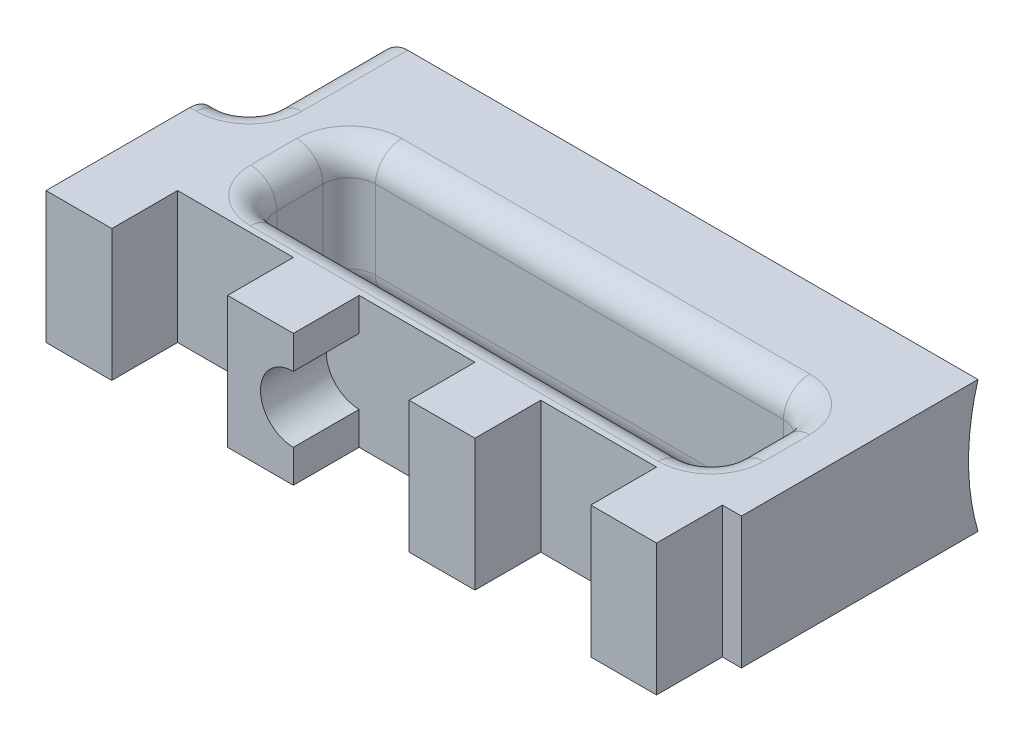
from build123d import *

# Parameters (mm, degrees)
SKETCH1_W           = 44.45
SKETCH1_H           = 9.525
BOSS_EXTRUDE1_DEPTH = 12.7
FILLET1_R           = 2.54
FILLET2_R           = 2.54
CUT_EXTRUDE2_DEPTH  = 6.35
CUT_EXTRUDE6_DEPTH  = 68.493049433
CUT_EXTRUDE7_DEPTH  = 3.175
SKETCH5_W           = 9.525
SKETCH5_H           = 12.7
CUT_EXTRUDE8_DEPTH  = 3.175
FILLET3_R           = 2.54


with BuildPart() as part:
    # Sketch1 → Boss-Extrude1 (new body)
    with BuildSketch(Plane(origin=(0, 0, 0), x_dir=(1, 0, 0), z_dir=(0, 1, 0))):
        Polygon((26.819703528, -20.131014632), (28.659931952, -20.131014632), (28.659931952, 17.968985368), (-28.898317878, 17.968985368), (-28.898317878, 12.851244956), (-32.108296472, 12.851244956), (-32.108296472, -20.131014632), (-32.108296472, -26.481014632), (-25.758296472, -26.481014632), (-25.758296472, -20.131014632), (-14.582296472, -20.131014632), (-14.582296472, -26.481014632), (-8.232296472, -26.481014632), (-8.232296472, -20.131014632), (2.943703528, -20.131014632), (2.943703528, -26.481014632), (9.293703528, -26.481014632), (9.293703528, -20.131014632), (20.469703528, -20.131014632), (20.469703528, -26.481014632), (26.819703528, -26.481014632), align=None)
        with Locations((0.396638353, -12.259443339)):
            Rectangle(SKETCH1_W, SKETCH1_H, mode=Mode.SUBTRACT)
    extrude(amount=BOSS_EXTRUDE1_DEPTH)

    # Fillet1
    fillet1_edges = [part.edges().sort_by_distance(p)[0] for p in [
        (22.621638353, 6.35, 17.021943339),
        (22.621638353, 6.35, 7.496943339),
        (-21.828361647, 6.35, 7.496943339),
        (-21.828361647, 6.35, 17.021943339),
    ]]
    fillet(fillet1_edges, radius=FILLET1_R)

    # Fillet2
    fillet2_edges = [part.edges().sort_by_distance(p)[0] for p in [
        (0.396638353, 0, 17.021943339),
        (0.396638353, 12.7, 17.021943339),
        (22.621638353, 0, 12.259443339),
        (22.621638353, 12.7, 12.259443339),
        (0.396638353, 0, 7.496943339),
        (0.396638353, 12.7, 7.496943339),
        (-21.828361647, 0, 12.259443339),
        (-21.828361647, 12.7, 12.259443339),
        (21.877689577, 0, 16.277994563),
        (21.877689577, 12.7, 16.277994563),
        (21.877689577, 0, 8.240892115),
        (21.877689577, 12.7, 8.240892115),
        (-21.084412871, 0, 8.240892115),
        (-21.084412871, 12.7, 8.240892115),
        (-21.084412871, 0, 16.277994563),
        (-21.084412871, 12.7, 16.277994563),
    ]]
    fillet(fillet2_edges, radius=FILLET2_R)

    # Sketch3 → Cut-Extrude2 (cut)
    with BuildSketch(Plane.XY.offset(26.481014632)):
        with BuildLine():
            Line((-8.232296472, 9.525), (-8.232296472, 3.175))
            ThreePointArc((-8.232296472, 3.175), (-11.407296472, 6.35), (-8.232296472, 9.525))
        make_face()
    extrude(amount=-CUT_EXTRUDE2_DEPTH, mode=Mode.SUBTRACT)

    # Sketch2 → Cut-Extrude6 (cut, through all)
    with BuildSketch(Plane(origin=(28.659931952, 0, 0), x_dir=(0, 0, -1), z_dir=(1, 0, 0))):
        with BuildLine():
            Line((2.702570586, 12.7), (17.968985368, 12.7))
            Line((17.968985368, 12.7), (17.968985368, 0))
            Line((17.968985368, 0), (2.702570586, 0))
            ThreePointArc((2.702570586, 0), (1.789185368, 6.35), (2.702570586, 12.7))
        make_face()
    extrude(amount=-CUT_EXTRUDE6_DEPTH, mode=Mode.SUBTRACT)

    # Sketch4 → Cut-Extrude7 (cut)
    with BuildSketch(Plane.ZY.offset(32.108296472)):
        with BuildLine():
            Line((0.536702432, 0), (-10.240735591, 0))
            Line((-10.240735591, 0), (-10.240735591, 12.7))
            Line((-10.240735591, 12.7), (0.536702432, 12.7))
            ThreePointArc((0.536702432, 12.7), (1.335014632, 6.35), (0.536702432, 0))
        make_face()
    extrude(amount=-CUT_EXTRUDE7_DEPTH, mode=Mode.SUBTRACT)

    # Sketch5 → Cut-Extrude8 (cut)
    with BuildSketch(Plane.ZY.offset(32.108296472)):
        with Locations((5.299202432, 6.35)):
            Rectangle(SKETCH5_W, SKETCH5_H)
    extrude(amount=-CUT_EXTRUDE8_DEPTH, mode=Mode.SUBTRACT)

    # Fillet3
    fillet3_edges = [part.edges().sort_by_distance(p)[0] for p in [
        (-28.933296472, 0, 3.679565923),
        (-28.933296472, 12.7, 3.679565923),
        (-28.933296472, 6.35, 10.061702432),
        (-30.520796472, 12.7, 10.061702432),
        (-30.520796472, 0, 10.061702432),
    ]]
    fillet(fillet3_edges, radius=FILLET3_R)


solid = part.part
